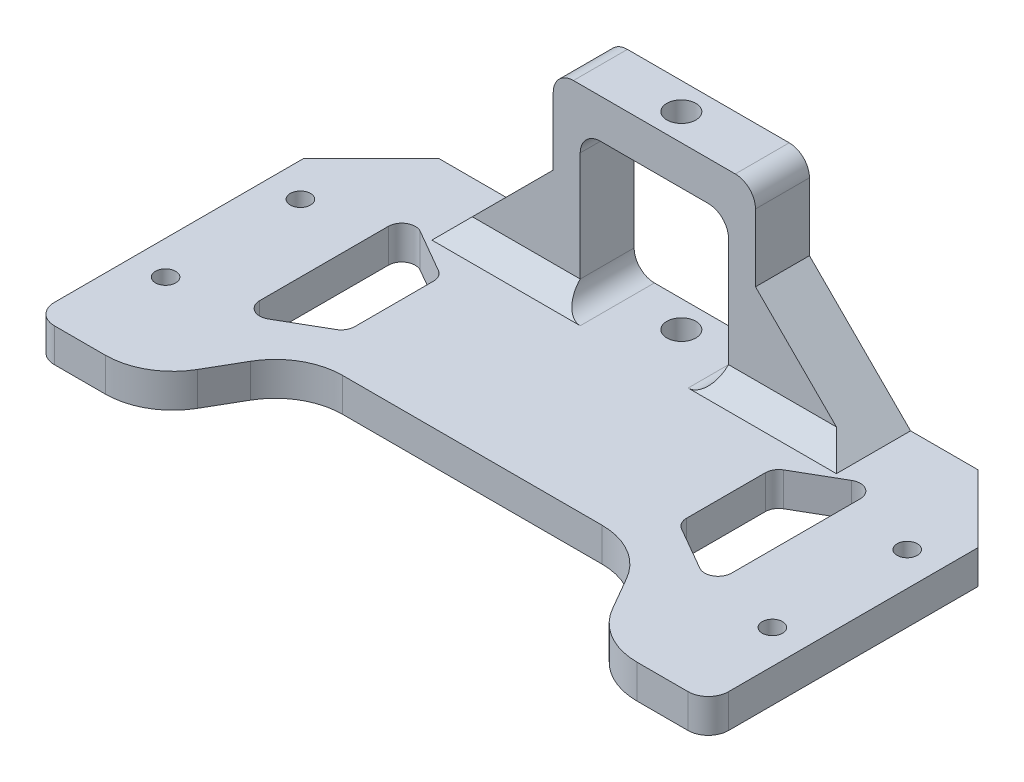
from build123d import *

# Parameters (mm, degrees)
EXTRUDE_1_DEPTH     = 5
FILLET_1_R          = 10
EXTRUDE_2_DEPTH     = 8
FILLET_4_R          = 3
SKETCH_3_R          = 1.5
CUT_EXTRUDE_1_DEPTH = 5
CHAMFER_1_SIZE      = 10
FILLET_5_R          = 3
CUT_EXTRUDE_2_DEPTH = 5
FILLET_6_R          = 2
FILLET_7_R          = 2
CHAMFER_2_SIZE      = 15
FILLET_8_R          = 3
SKETCH_6_R          = 2.15
CUT_EXTRUDE_3_DEPTH = 52
CHAMFER_3_SIZE      = 3


with BuildPart() as part:
    # 草图1 → 凸台-拉伸1 (new body)
    with BuildSketch(Plane(origin=(0, 0, 0), x_dir=(1, 0, 0), z_dir=(0, 1, 0))):
        Polygon((-50, -25), (-33.660254038, -25), (-25, -10), (25, -10), (33.660254038, -25), (50, -25), (50, 25), (-50, 25), align=None)
    extrude(amount=EXTRUDE_1_DEPTH)

    # 圆角1
    fillet_1_edges = [part.edges().sort_by_distance(p)[0] for p in [
        (-25, 2.5, 10),
        (-33.660254038, 2.5, 25),
        (33.660254038, 2.5, 25),
        (25, 2.5, 10),
    ]]
    fillet(fillet_1_edges, radius=FILLET_1_R)

    # 草图2 → 凸台-拉伸2 (add)
    with BuildSketch(Plane(origin=(0, 0, -25), x_dir=(-1, 0, 0), z_dir=(0, 0, -1))):
        Polygon((-15, 33), (-15, 5), (-11, 5), (-11, 27.2), (0, 27.2), (11, 27.2), (11, 5), (15, 5), (15, 33), align=None)
    extrude(amount=-EXTRUDE_2_DEPTH)

    # 圆角4
    fillet_4_edges = [part.edges().sort_by_distance(p)[0] for p in [
        (15, 33, -21),
        (-15, 33, -21),
    ]]
    fillet(fillet_4_edges, radius=FILLET_4_R)

    # 草图3 → 切除-拉伸1 (cut)
    with BuildSketch(Plane.XZ):
        with Locations(Location((-45, 10.5, 0), (0, 0, 270))):
            Circle(SKETCH_3_R)
        with Locations(Location((-45, -9.5, 0), (0, 0, 270))):
            Circle(SKETCH_3_R)
        with Locations(Location((45, -9.5, 0), (0, 0, 90))):
            Circle(SKETCH_3_R)
        with Locations(Location((45, 10.5, 0), (0, 0, 90))):
            Circle(SKETCH_3_R)
    extrude(amount=-CUT_EXTRUDE_1_DEPTH, mode=Mode.SUBTRACT)

    # 倒角1
    chamfer_1_edges = [part.edges().sort_by_distance(p)[0] for p in [
        (-50, 2.5, -25),
        (50, 2.5, -25),
    ]]
    chamfer(chamfer_1_edges, length=CHAMFER_1_SIZE)

    # 圆角5
    fillet_5_edges = [part.edges().sort_by_distance(p)[0] for p in [
        (-50, 2.5, 25),
        (50, 2.5, 25),
    ]]
    fillet(fillet_5_edges, radius=FILLET_5_R)

    # 草图4 → 切除-拉伸2 (cut)
    with BuildSketch(Plane(origin=(0, 5, 0), x_dir=(1, 0, 0), z_dir=(0, 1, 0))):
        Polygon((-35, 16), (-35, -10), (-24.607695155, -4), (-24.607695155, 10), align=None)
        Polygon((24.607695155, -4), (24.607695155, 10), (35, 16), (35, -10), align=None)
    extrude(amount=-CUT_EXTRUDE_2_DEPTH, mode=Mode.SUBTRACT)

    # 圆角6
    fillet_6_edges = [part.edges().sort_by_distance(p)[0] for p in [
        (-35, 2.5, -16),
        (-24.607695155, 2.5, -10),
        (-24.607695155, 2.5, 4),
        (-35, 2.5, 10),
    ]]
    fillet(fillet_6_edges, radius=FILLET_6_R)

    # 圆角7
    fillet_7_edges = [part.edges().sort_by_distance(p)[0] for p in [
        (35, 2.5, 10),
        (24.607695155, 2.5, 4),
        (24.607695155, 2.5, -10),
        (35, 2.5, -16),
    ]]
    fillet(fillet_7_edges, radius=FILLET_7_R)

    # 倒角2
    chamfer_2_edges = [part.edges().sort_by_distance(p)[0] for p in [
        (15, 5, -21),
        (-15, 5, -21),
    ]]
    chamfer(chamfer_2_edges, length=CHAMFER_2_SIZE)

    # 圆角8
    fillet_8_edges = [part.edges().sort_by_distance(p)[0] for p in [
        (-11, 5, -21),
        (-11, 27.2, -21),
        (11, 27.2, -21),
        (11, 5, -21),
    ]]
    fillet(fillet_8_edges, radius=FILLET_8_R)

    # 草图6 → 切除-拉伸3 (cut)
    with BuildSketch(Plane(origin=(0, 33, 0), x_dir=(1, 0, 0), z_dir=(0, 1, 0))):
        with Locations(Location((0, 21, 0), (0, 0, 270))):
            Circle(SKETCH_6_R)
    extrude(amount=-CUT_EXTRUDE_3_DEPTH, mode=Mode.SUBTRACT)

    # 倒角3
    chamfer_3_edges = [part.edges().sort_by_distance(p)[0] for p in [
        (19, 5, -17),
        (-19, 5, -17),
    ]]
    chamfer(chamfer_3_edges, length=CHAMFER_3_SIZE)


solid = part.part
